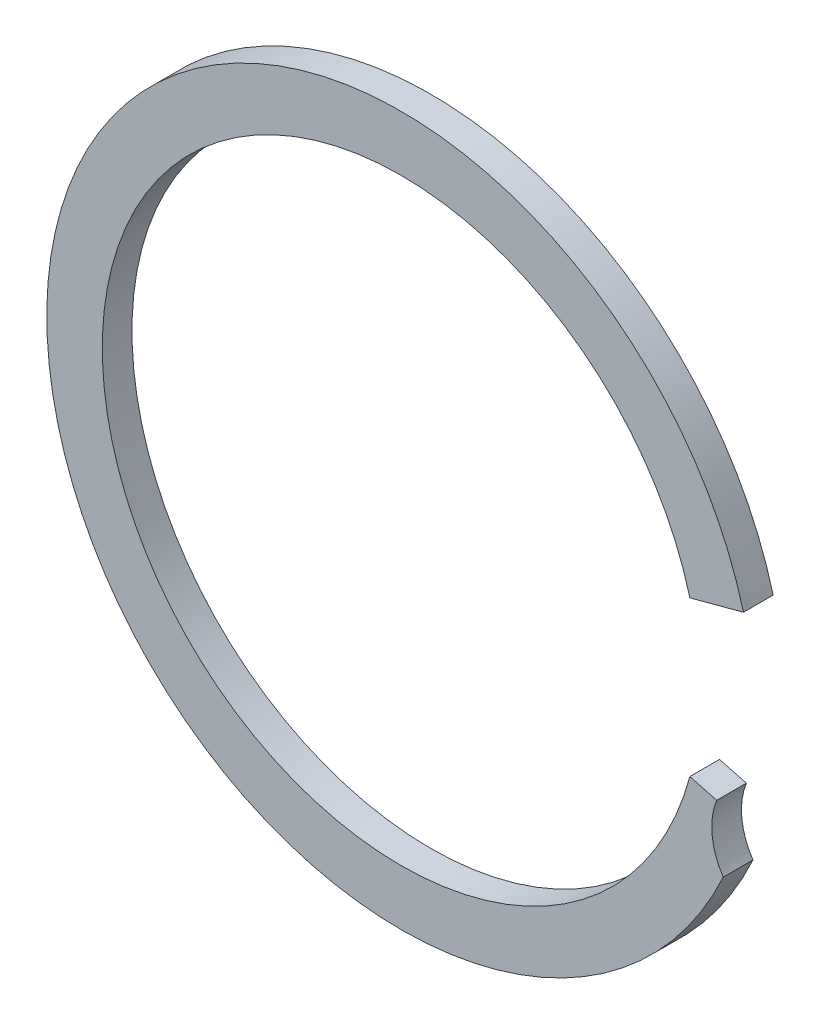
from build123d import *

# Parameters (mm, degrees)
BOSS_EXTRUDE1_DEPTH = 1.15


with BuildPart() as part:
    # Sketch2 → Boss-Extrude1 (new body)
    with BuildSketch(Plane.XY):
        with BuildLine():
            Line((11.185421068, 2.997124542), (12.223791332, 3.275355016))
            Line((12.223791332, 3.275355016), (13.262161595, 3.553585489))
            ThreePointArc((13.262161595, 3.553585489), (-13.681339039, 1.154929476), (12.47876657, -5.726542141))
            ThreePointArc((12.47876657, -5.726542141), (12.047423687, -4.532555944), (12.223791332, -3.275355016))
            Line((12.223791332, -3.275355016), (11.185421068, -2.997124542))
            ThreePointArc((11.185421068, -2.997124542), (-11.58, 0), (11.185421068, 2.997124542))
        make_face()
    extrude(amount=BOSS_EXTRUDE1_DEPTH)


solid = part.part
